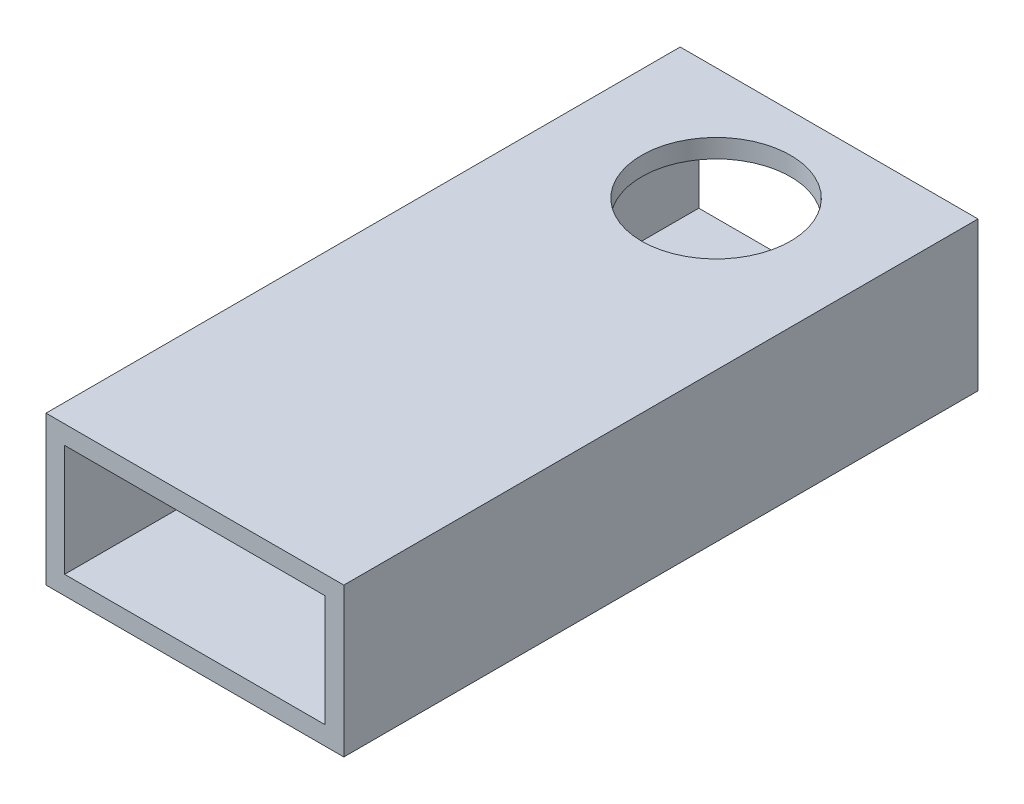
from build123d import *

# Parameters (mm, degrees)
SKETCH1_W           = 50.8
SKETCH1_H           = 25.4
BOSS_EXTRUDE1_DEPTH = 108.1786
SKETCH2_W           = 44.45
SKETCH2_H           = 19.05
CUT_EXTRUDE1_DEPTH  = 123.181870578
SKETCH3_R           = 12.7
CUT_EXTRUDE2_DEPTH  = 3.175
SKETCH5_R           = 6.35
CUT_EXTRUDE3_DEPTH  = 108.1786


with BuildPart() as part:
    # Sketch1 → Boss-Extrude1 (new body)
    with BuildSketch(Plane.XY):
        with Locations((25.4, -12.7)):
            Rectangle(SKETCH1_W, SKETCH1_H)
    extrude(amount=BOSS_EXTRUDE1_DEPTH)

    # Sketch2 → Cut-Extrude1 (cut, through all)
    with BuildSketch(Plane.XY.offset(108.1786)):
        with Locations((25.4, -12.7)):
            Rectangle(SKETCH2_W, SKETCH2_H)
    extrude(amount=-CUT_EXTRUDE1_DEPTH, mode=Mode.SUBTRACT)

    # Sketch3 → Cut-Extrude2 (cut)
    with BuildSketch(Plane(origin=(0, 0, 0), x_dir=(1, 0, 0), z_dir=(0, 1, 0))):
        with Locations(Location((25.4, -19.2786, 0), (0, 0, 270))):
            Circle(SKETCH3_R)
    extrude(amount=-CUT_EXTRUDE2_DEPTH, mode=Mode.SUBTRACT)

    # Sketch5 → Cut-Extrude3 (cut)
    with BuildSketch(Plane.XZ.offset(25.4)):
        with Locations(Location((25.4, 19.2786, 0), (0, 0, 270))):
            Circle(SKETCH5_R)
    extrude(amount=-CUT_EXTRUDE3_DEPTH, mode=Mode.SUBTRACT)


solid = part.part
